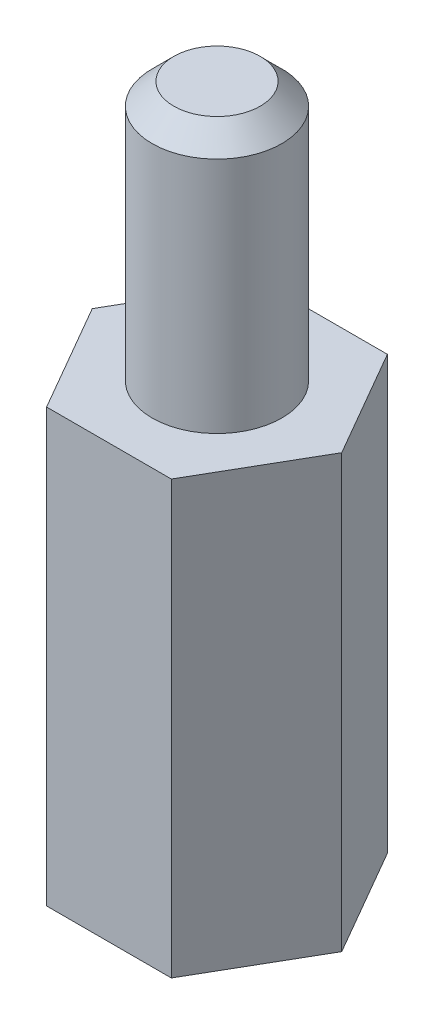
from build123d import *

# Parameters (mm, degrees)
EXTRUDE_1_DEPTH           = 10
HOLE_WIZARD_3_0_3_1_D     = 3
HOLE_WIZARD_3_0_3_1_DEPTH = 8.5
HOLE_WIZARD_3_0_3_1_TIP   = 0.901290929
EXTRUDE_START             = 6
SKETCH_4_R                = 1.5
EXTRUDE_2_DEPTH           = 6
CHAMFER_1_SIZE            = 0.5


with BuildPart() as part:
    # Эскиз1 → Бобышка-Вытянуть1 (new body)
    with BuildSketch(Plane(origin=(0, 0, 0), x_dir=(1, 0, 0), z_dir=(0, 1, 0))):
        Polygon((1.443375673, -2.5), (2.886751346, 0), (1.443375673, 2.5), (-1.443375673, 2.5), (-2.886751346, 0), (-1.443375673, -2.5), align=None)
    extrude(amount=EXTRUDE_1_DEPTH)

    # Диаметр отверстия Ø3.0 (3)1
    with Locations(Plane(origin=(0, 0, 0), x_dir=(-1, 0, 0), z_dir=(0, -1, 0))):
        with Locations((0, 0)):
            Hole(HOLE_WIZARD_3_0_3_1_D / 2, depth=HOLE_WIZARD_3_0_3_1_DEPTH)
            with Locations((0, 0, -(HOLE_WIZARD_3_0_3_1_DEPTH + HOLE_WIZARD_3_0_3_1_TIP / 2))):  # 118° drill point
                Cone(0, HOLE_WIZARD_3_0_3_1_D / 2, HOLE_WIZARD_3_0_3_1_TIP, mode=Mode.SUBTRACT)

    # Эскиз4 → Бобышка-Вытянуть2 (add)
    with BuildSketch(Plane(origin=(0, 10, 0), x_dir=(1, 0, 0), z_dir=(0, 1, 0)).offset(EXTRUDE_START)):
        with Locations(Location((0, 0, 0), (0, 0, 90))):
            Circle(SKETCH_4_R)
    extrude(amount=-EXTRUDE_2_DEPTH)

    # Фаска1
    chamfer_1_edges = [part.edges().sort_by_distance(p)[0] for p in [
        (-1.5, 0, 0),
        (0, 16, 1.5),
    ]]
    chamfer(chamfer_1_edges, length=CHAMFER_1_SIZE)


solid = part.part
